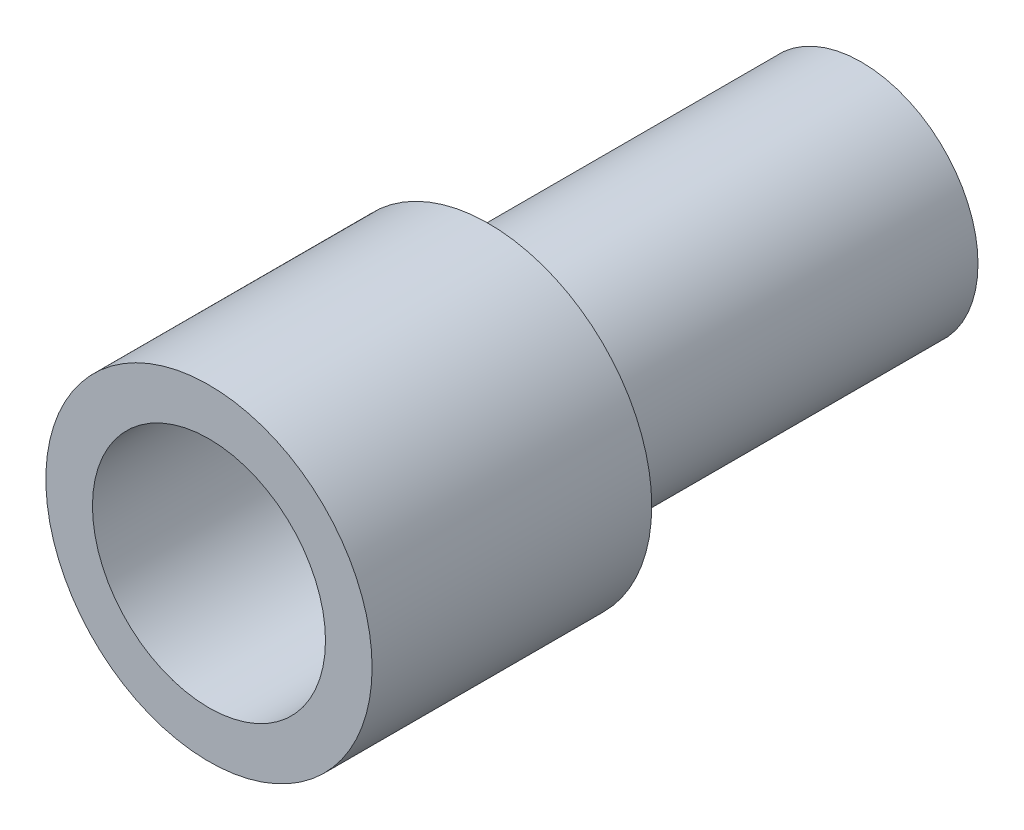
from build123d import *

# Parameters (mm, degrees)
ESQUISSE1_R             = 3.5
BOSS_EXTRU_2_DEPTH      = 6
ESQUISSE3_R             = 2.5
ENL_V_MAT_EXTRU_1_DEPTH = 5
ESQUISSE4_R             = 2.5
BOSS_EXTRU_3_DEPTH      = 8


with BuildPart() as part:
    # Esquisse1 → Boss.-Extru.2 (new body)
    with BuildSketch(Plane.XY):
        Circle(ESQUISSE1_R)
    extrude(amount=BOSS_EXTRU_2_DEPTH)

    # Esquisse3 → Enlèv. mat.-Extru.1 (cut)
    with BuildSketch(Plane.XY.offset(6)):
        Circle(ESQUISSE3_R)
    extrude(amount=-ENL_V_MAT_EXTRU_1_DEPTH, mode=Mode.SUBTRACT)

    # Esquisse4 → Boss.-Extru.3 (add)
    with BuildSketch(Plane(origin=(0, 0, 0), x_dir=(-1, 0, 0), z_dir=(0, 0, -1))):
        with Locations(Location((0, 0, 0), (0, 0, 180))):
            Circle(ESQUISSE4_R)
    extrude(amount=BOSS_EXTRU_3_DEPTH)


solid = part.part
